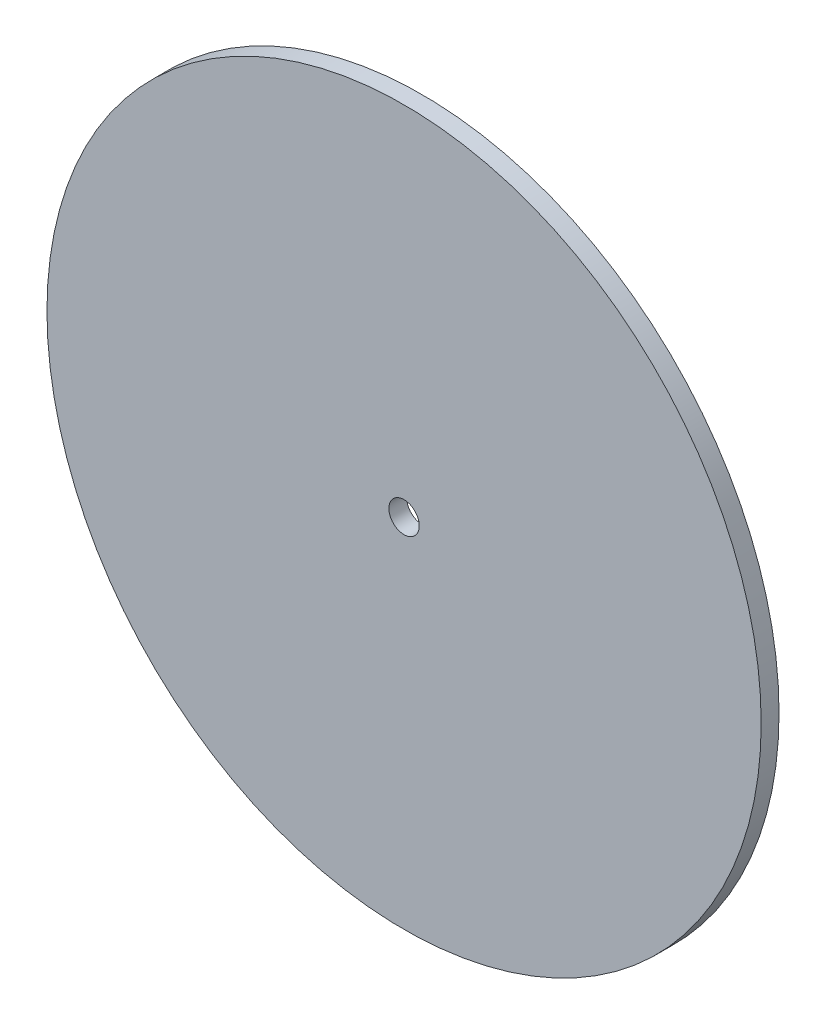
from build123d import *

# Parameters (mm, degrees)
SKETCH1_R           = 20
SKETCH1_R_2         = 0.85
BOSS_EXTRUDE1_DEPTH = 1


with BuildPart() as part:
    # Sketch1 → Boss-Extrude1 (new body)
    with BuildSketch(Plane.XY):
        Circle(SKETCH1_R)
        Circle(SKETCH1_R_2, mode=Mode.SUBTRACT)
    extrude(amount=BOSS_EXTRUDE1_DEPTH)


solid = part.part
